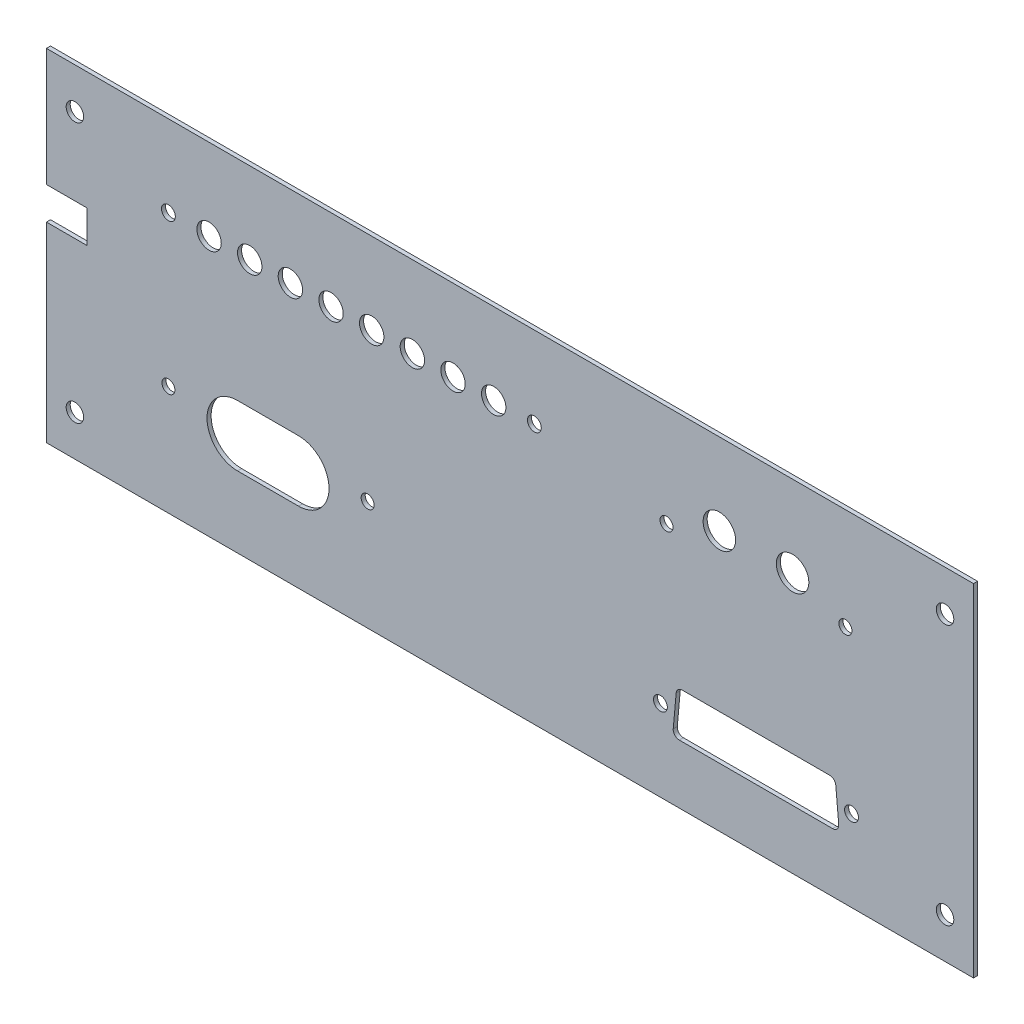
from build123d import *

# Parameters (mm, degrees)
SKETCH_1_W          = 228
SKETCH_1_H          = 84
SKETCH_1_R          = 2.15
EXTRUDE_1_DEPTH     = 1
SKETCH_3_R          = 1.7
SKETCH_3_R_2        = 1.6
SKETCH_3_R_3        = 4
CUT_EXTRUDE_1_DEPTH = 10
SKETCH_4_R          = 1.6
SKETCH_4_W          = 16.398551469
SKETCH_4_H          = 8
CUT_EXTRUDE_2_DEPTH = 1
SKETCH_5_R          = 1.7
SKETCH_5_R_2        = 3
CUT_EXTRUDE_3_DEPTH = 10


with BuildPart() as part:
    # Эскиз1 → Вытянуть1 (new body)
    with BuildSketch(Plane.XY):
        Rectangle(SKETCH_1_W, SKETCH_1_H)
        with Locations((107, 32)):
            Circle(SKETCH_1_R, mode=Mode.SUBTRACT)
        with Locations(Location((-107, 32, 0), (0, 0, 180))):
            Circle(SKETCH_1_R, mode=Mode.SUBTRACT)
        with Locations((-107, -32)):
            Circle(SKETCH_1_R, mode=Mode.SUBTRACT)
        with Locations(Location((107, -32, 0), (0, 0, 180))):
            Circle(SKETCH_1_R, mode=Mode.SUBTRACT)
    extrude(amount=EXTRUDE_1_DEPTH)

    # Эскиз3 → Вырез-Вытянуть1 (cut)
    with BuildSketch(Plane.XY.offset(1)):
        with Locations((37, -22)):
            Circle(SKETCH_3_R)
        with Locations((84, -22)):
            Circle(SKETCH_3_R)
        with Locations((38.5, 17)):
            Circle(SKETCH_3_R_2)
        with Locations((82.5, 17)):
            Circle(SKETCH_3_R_2)
        with Locations((51.5, 22)):
            Circle(SKETCH_3_R_3)
        with Locations((69.5, 22)):
            Circle(SKETCH_3_R_3)
        with BuildLine():
            Line((40.14870942, -25.864196381), (40.875982147, -17.864196381))
            ThreePointArc((40.875982147, -17.864196381), (41.358314525, -16.892366164), (42.369821957, -16.5))
            Line((42.369821957, -16.5), (78.630178043, -16.5))
            ThreePointArc((78.630178043, -16.5), (79.641685475, -16.892366164), (80.124017853, -17.864196381))
            Line((80.124017853, -17.864196381), (80.85129058, -25.864196381))
            ThreePointArc((80.85129058, -25.864196381), (80.465084606, -27.011507432), (79.35745077, -27.5))
            Line((79.35745077, -27.5), (41.64254923, -27.5))
            ThreePointArc((41.64254923, -27.5), (40.534915394, -27.011507432), (40.14870942, -25.864196381))
        make_face()
    extrude(amount=-CUT_EXTRUDE_1_DEPTH, mode=Mode.SUBTRACT)

    # Эскиз4 → Вырез-Вытянуть2 (cut)
    with BuildSketch(Plane.XY.offset(1)):
        with Locations((-84, -15)):
            Circle(SKETCH_4_R)
        with Locations((-35, -15)):
            Circle(SKETCH_4_R)
        with BuildLine():
            Line((-67, -9.5), (-52, -9.5))
            ThreePointArc((-52, -9.5), (-44.5, -17), (-52, -24.5))
            Line((-52, -24.5), (-67, -24.5))
            ThreePointArc((-67, -24.5), (-74.5, -17), (-67, -9.5))
        make_face()
        with Locations((-112.199275735, 9)):
            Rectangle(SKETCH_4_W, SKETCH_4_H)
    extrude(amount=-CUT_EXTRUDE_2_DEPTH, mode=Mode.SUBTRACT)

    # Эскиз5 → Вырез-Вытянуть3 (cut)
    with BuildSketch(Plane.XY.offset(1)):
        with Locations((-84, 22)):
            Circle(SKETCH_5_R)
        with Locations((6, 22)):
            Circle(SKETCH_5_R)
        with Locations((-4, 22)):
            Circle(SKETCH_5_R_2)
        with Locations((-14, 22)):
            Circle(SKETCH_5_R_2)
        with Locations((-24, 22)):
            Circle(SKETCH_5_R_2)
        with Locations((-34, 22)):
            Circle(SKETCH_5_R_2)
        with Locations((-44, 22)):
            Circle(SKETCH_5_R_2)
        with Locations((-54, 22)):
            Circle(SKETCH_5_R_2)
        with Locations((-64, 22)):
            Circle(SKETCH_5_R_2)
        with Locations((-74, 22)):
            Circle(SKETCH_5_R_2)
    extrude(amount=-CUT_EXTRUDE_3_DEPTH, mode=Mode.SUBTRACT)


solid = part.part
